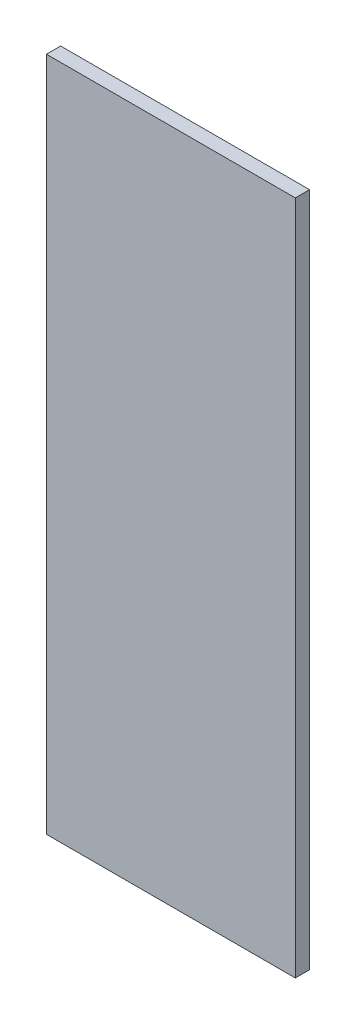
from build123d import *

# Parameters (mm, degrees)
SKETCH1_W           = 3.5
SKETCH1_H           = 9.5
BOSS_EXTRUDE1_DEPTH = 0.2


with BuildPart() as part:
    # Sketch1 → Boss-Extrude1 (new body)
    with BuildSketch(Plane.XY):
        with Locations((1.75, 4.75)):
            Rectangle(SKETCH1_W, SKETCH1_H)
    extrude(amount=BOSS_EXTRUDE1_DEPTH)


solid = part.part
